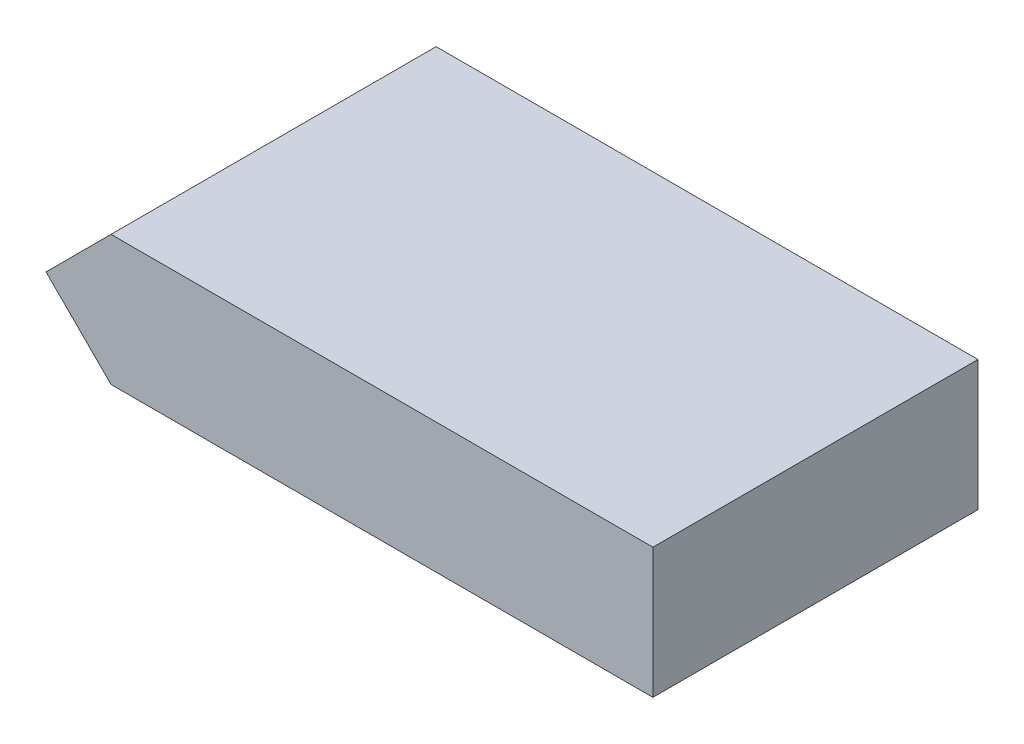
from build123d import *

# Parameters (mm, degrees)
BOSS_EXTRUDE1_DEPTH = 15


with BuildPart() as part:
    # Sketch1 → Boss-Extrude1 (new, symmetric)
    with BuildSketch(Plane.XY):
        Polygon((0, 0), (6, 6), (56, 6), (56, -6), (6, -6), align=None)
    extrude(amount=BOSS_EXTRUDE1_DEPTH, both=True)


solid = part.part
